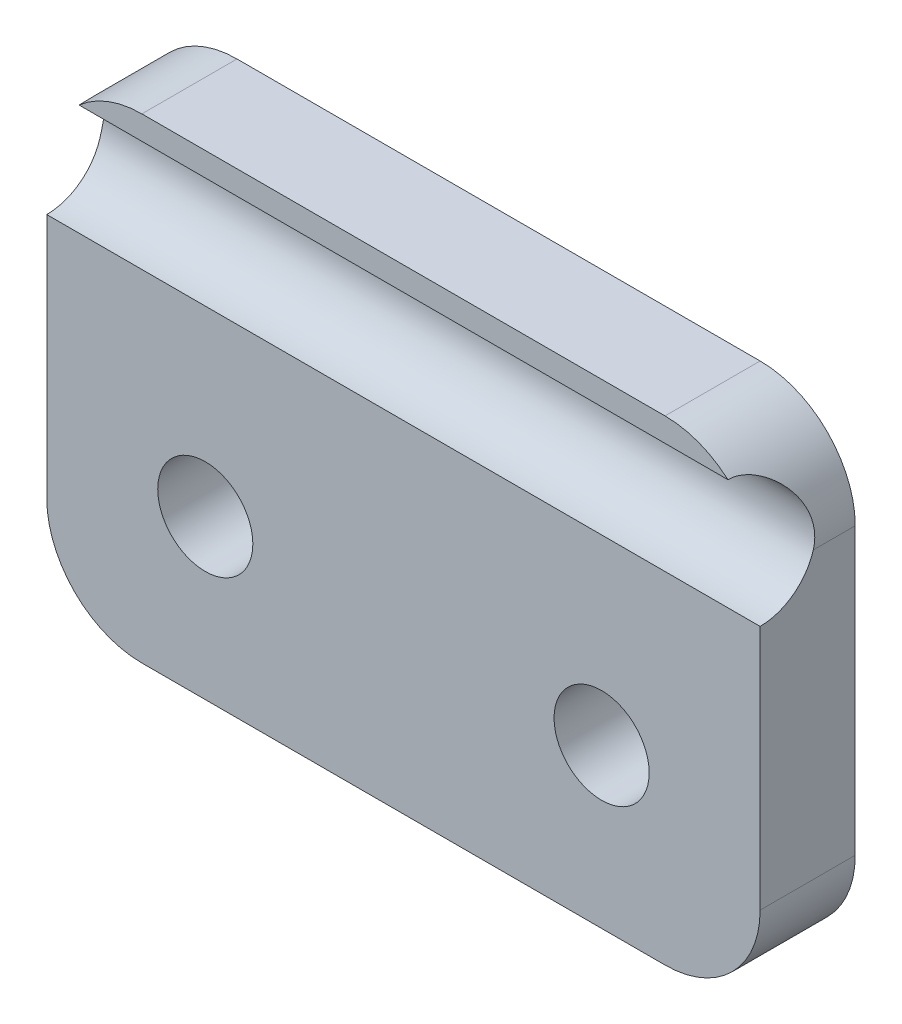
from build123d import *

# Parameters (mm, degrees)
Y_KSEKLIK_EKSTR_ZYON1_DEPTH = 6
KES_EKSTR_ZYON1_DEPTH       = 28.699277969
KES_EKSTR_ZYON1_DEPTH_BACK  = 28.699277969
IZIM2_R                     = 3.5
IZIM3_R                     = 3
KES_EKSTR_ZYON2_DEPTH       = 44


with BuildPart() as part:
    # Çizim1 → Yükseklik-Ekstrüzyon1 (new body)
    with BuildSketch(Plane.XY):
        with BuildLine():
            Line((-16.5, -15), (16.5, -15))
            ThreePointArc((16.5, -15), (20.742640687, -13.242640687), (22.5, -9))
            Line((22.5, -9), (22.5, 9))
            ThreePointArc((22.5, 9), (20.742640687, 13.242640687), (16.5, 15))
            Line((16.5, 15), (-16.5, 15))
            ThreePointArc((-16.5, 15), (-20.742640687, 13.242640687), (-22.5, 9))
            Line((-22.5, 9), (-22.5, -9))
            ThreePointArc((-22.5, -9), (-20.742640687, -13.242640687), (-16.5, -15))
        make_face()
    extrude(amount=Y_KSEKLIK_EKSTR_ZYON1_DEPTH)

    # Çizim2 → Kes-Ekstrüzyon1 (cut, two sides: drawn at the far end of the back side and taken through both)
    with BuildSketch(Plane(origin=(0, 0, 0), x_dir=(0, 0, -1), z_dir=(1, 0, 0)).offset(-KES_EKSTR_ZYON1_DEPTH_BACK)):
        with Locations((-6, 10)):
            Circle(IZIM2_R)
    extrude(amount=KES_EKSTR_ZYON1_DEPTH + KES_EKSTR_ZYON1_DEPTH_BACK, mode=Mode.SUBTRACT)

    # Çizim3 → Kes-Ekstrüzyon2 (cut)
    with BuildSketch(Plane(origin=(0, 0, 0), x_dir=(-1, 0, 0), z_dir=(0, 0, -1))):
        with Locations((12.5, -5)):
            Circle(IZIM3_R)
        with Locations((-12.5, -5)):
            Circle(IZIM3_R)
    extrude(amount=-KES_EKSTR_ZYON2_DEPTH, mode=Mode.SUBTRACT)


solid = part.part
